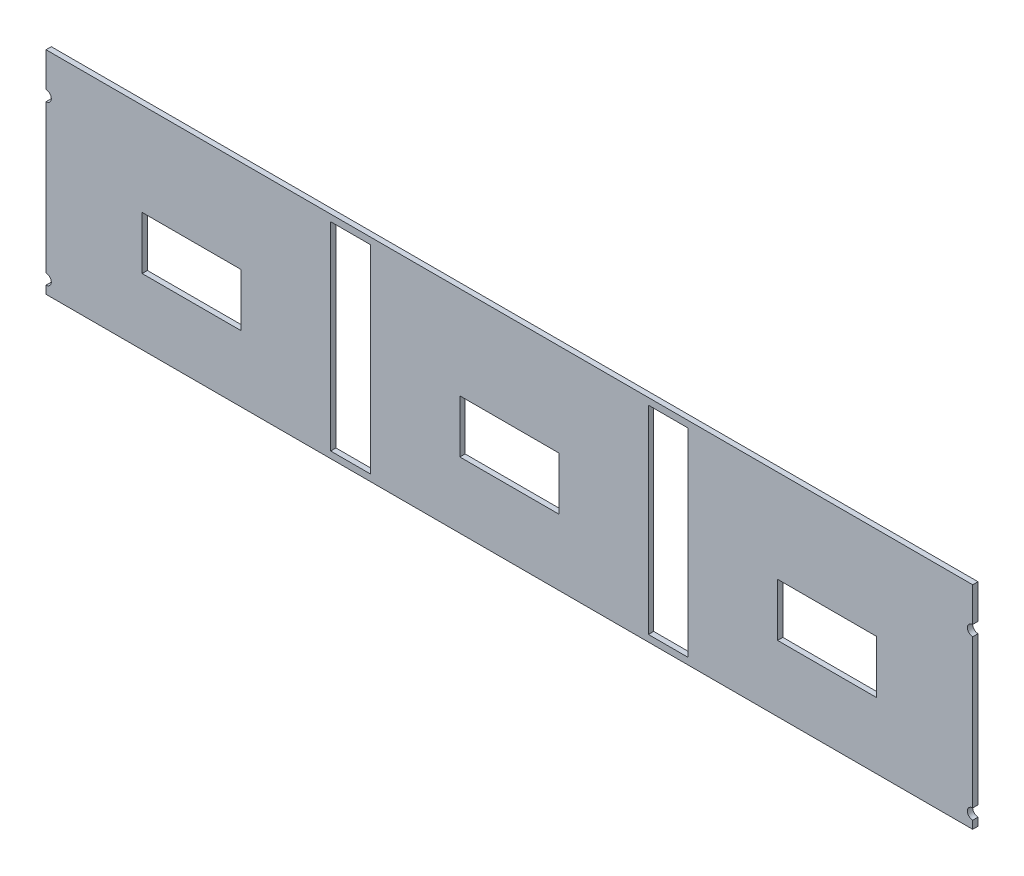
from build123d import *

# Parameters (mm, degrees)
SKETCH1_W           = 19.05
SKETCH1_H           = 95.25
BOSS_EXTRUDE2_DEPTH = 2.54


with BuildPart() as part:
    # Sketch1 → Boss-Extrude2 (new body)
    with BuildSketch(Plane.XY):
        with BuildLine():
            Line((-362.508916396, 81.370262461), (-362.508916396, 64.860262461))
            ThreePointArc((-362.508916396, 64.860262461), (-359.968916396, 62.320262461), (-362.508916396, 59.780262461))
            Line((-362.508916396, 59.780262461), (-362.508916396, -11.339737539))
            ThreePointArc((-362.508916396, -11.339737539), (-359.968916396, -13.879737539), (-362.508916396, -16.419737539))
            Line((-362.508916396, -16.419737539), (-362.508916396, -20.229737539))
            Line((-362.508916396, -20.229737539), (81.991083604, -20.229737539))
            Line((81.991083604, -20.229737539), (81.991083604, -16.419737539))
            ThreePointArc((81.991083604, -16.419737539), (79.451083604, -13.879737539), (81.991083604, -11.339737539))
            Line((81.991083604, -11.339737539), (81.991083604, 59.780262461))
            ThreePointArc((81.991083604, 59.780262461), (79.451083604, 62.320262461), (81.991083604, 64.860262461))
            Line((81.991083604, 64.860262461), (81.991083604, 81.370262461))
            Line((81.991083604, 81.370262461), (-362.508916396, 81.370262461))
        make_face()
        with Locations((-64.058916396, 30.570262461)):
            Rectangle(SKETCH1_W, SKETCH1_H, mode=Mode.SUBTRACT)
        Polygon((-316.407916396, 11.451682461), (-316.407916396, 36.851682461), (-292.658916396, 36.851682461), (-268.909916396, 36.851682461), (-268.909916396, 11.451682461), (-292.658916396, 11.451682461), align=None, mode=Mode.SUBTRACT)
        Polygon((-164.007916396, 11.451682461), (-164.007916396, 36.851682461), (-140.258916396, 36.851682461), (-116.509916396, 36.851682461), (-116.509916396, 11.451682461), (-140.258916396, 11.451682461), align=None, mode=Mode.SUBTRACT)
        with Locations((-216.458916396, 30.570262461)):
            Rectangle(SKETCH1_W, SKETCH1_H, mode=Mode.SUBTRACT)
        Polygon((-11.607916396, 11.451682461), (-11.607916396, 36.851682461), (12.141083604, 36.851682461), (35.890083604, 36.851682461), (35.890083604, 11.451682461), (12.141083604, 11.451682461), align=None, mode=Mode.SUBTRACT)
    extrude(amount=BOSS_EXTRUDE2_DEPTH)


solid = part.part
